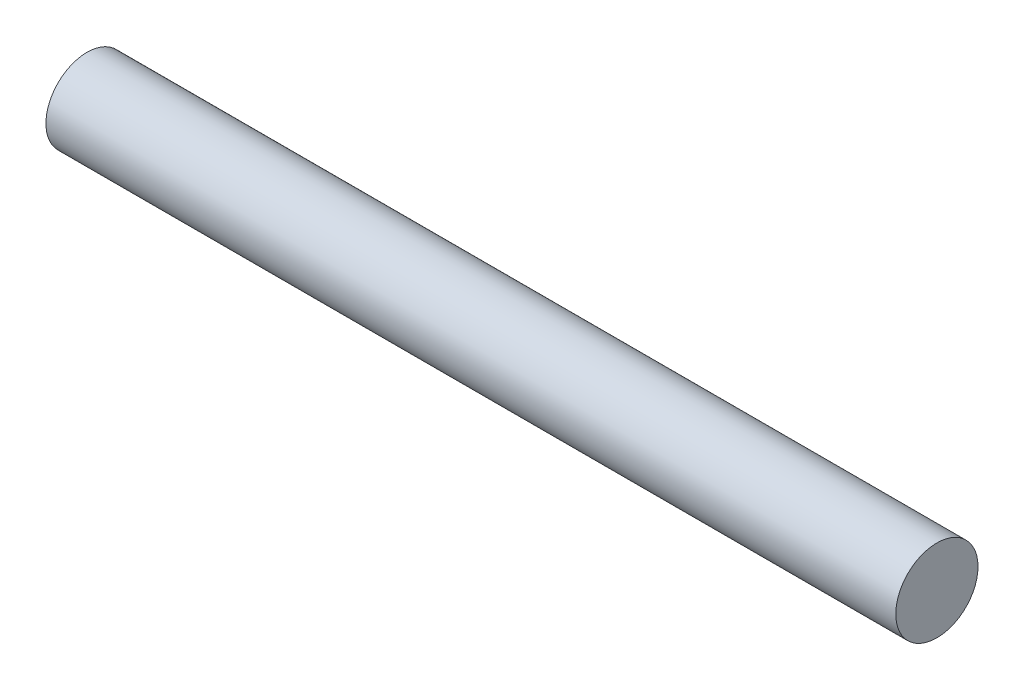
from build123d import *

# Parameters (mm, degrees)
SKETCH1_R           = 4.5
BOSS_EXTRUDE1_DEPTH = 93
CUT_EXTRUDE1_DEPTH  = 1


with BuildPart() as part:
    # Sketch1 → Boss-Extrude1 (new body)
    with BuildSketch(Plane(origin=(0, 0, 0), x_dir=(0, 0, -1), z_dir=(1, 0, 0))):
        with Locations(Location((0, 0, 0), (0, 0, 180))):
            Circle(SKETCH1_R)
    extrude(amount=BOSS_EXTRUDE1_DEPTH)

    # Sketch2 → Cut-Extrude1 (cut)
    # profile 1 of 6: a face of its own
    with BuildSketch(Plane(origin=(0, 0, -4.5), x_dir=(-1, 0, 0), z_dir=(0, 0, -1))):
        with BuildLine():
            Line((-51.504249312, 0.93588405), (-51.658483587, 0.80168433))
            add(Edge.make_bspline(
                [(-51.658483587, 0.80168433), (-51.682680833, 0.822813409), (-51.729786546, 0.863946201), (-51.803544139, 0.918280559), (-51.877714446, 0.964110102), (-51.952317104, 1.000887718), (-52.026092846, 1.030344179), (-52.099377852, 1.050595394), (-52.171589413, 1.063825819), (-52.219608453, 1.065460893), (-52.243301796, 1.066267663)],
                knots=[0, 0, 0, 0, 1.174203348, 2.285866929, 3.345479548, 4.357773815, 5.323690501, 6.245291137, 7.134199255, 8, 8, 8, 8], degree=3))
            add(Edge.make_bspline(
                [(-52.243301796, 1.066267663), (-52.256987604, 1.066053279), (-52.28431643, 1.065625181), (-52.325090263, 1.061223075), (-52.365466545, 1.054656517), (-52.405469856, 1.045258656), (-52.445184825, 1.033671189), (-52.484307451, 1.01889454), (-52.523078464, 1.001609771), (-52.561183632, 0.981718256), (-52.598220313, 0.959652067), (-52.633421041, 0.935367083), (-52.666566358, 0.908902737), (-52.697718378, 0.880333906), (-52.726694149, 0.849616982), (-52.753923076, 0.817193865), (-52.778699937, 0.782304492), (-52.801507037, 0.745700204), (-52.82161973, 0.707640966), (-52.839722592, 0.669042627), (-52.854625437, 0.629577847), (-52.866686237, 0.589378017), (-52.876292343, 0.548495713), (-52.883265639, 0.506975971), (-52.887580874, 0.464687013), (-52.888008118, 0.43630243), (-52.888223671, 0.421981806)],
                knots=[0, 0, 0, 0, 0.9732313, 1.943419598, 2.914105962, 3.881741322, 4.864768402, 5.855028487, 6.854206409, 7.882911434, 8.911035887, 9.919250175, 10.922630637, 11.925982763, 12.923451909, 13.924676513, 14.935397504, 15.964931351, 16.990480746, 17.995899336, 18.995873688, 19.988284801, 20.979664002, 21.981342857, 22.981544644, 24, 24, 24, 24], degree=3))
            add(Edge.make_bspline(
                [(-52.888223671, 0.421981806), (-52.887859105, 0.407345906), (-52.887131227, 0.378124466), (-52.883090163, 0.334626805), (-52.875691921, 0.291928846), (-52.865415293, 0.249982462), (-52.852431695, 0.20873611), (-52.836508135, 0.168083565), (-52.817217505, 0.128432205), (-52.795824555, 0.089417715), (-52.771750803, 0.051973789), (-52.74516781, 0.016679783), (-52.716973044, -0.016920192), (-52.686320176, -0.047890755), (-52.654133154, -0.077268161), (-52.619289832, -0.103760891), (-52.582769256, -0.128671137), (-52.544328165, -0.151237262), (-52.504306788, -0.171138722), (-52.463368575, -0.188698257), (-52.421379783, -0.203378731), (-52.378599726, -0.215479126), (-52.334803993, -0.224680453), (-52.290310373, -0.231283397), (-52.244873975, -0.235679651), (-52.214267359, -0.236089206), (-52.198780562, -0.236296439)],
                knots=[0, 0, 0, 0, 0.993588149, 1.983757546, 2.962012758, 3.932297264, 4.913089422, 5.895147596, 6.892791648, 7.904042674, 8.913936126, 9.911190904, 10.901569418, 11.888649192, 12.866825019, 13.856968273, 14.856789458, 15.866221433, 16.879824684, 17.888846278, 18.887838639, 19.896937192, 20.90452114, 21.923117541, 22.949107649, 24, 24, 24, 24], degree=3))
            add(Edge.make_bspline(
                [(-52.198780562, -0.236296439), (-52.179468786, -0.235861841), (-52.14137558, -0.235004581), (-52.085460528, -0.228440235), (-52.031691729, -0.218304732), (-51.980617041, -0.202551834), (-51.931422057, -0.183815113), (-51.884840657, -0.159946502), (-51.840315084, -0.132271765), (-51.798802114, -0.100162562), (-51.760114408, -0.065578891), (-51.725661578, -0.028347496), (-51.694850486, 0.010323662), (-51.6688733, 0.051363292), (-51.64632454, 0.093621142), (-51.628462927, 0.137988147), (-51.614617423, 0.184087288), (-51.608891411, 0.215843954), (-51.606012133, 0.231812535)],
                knots=[0, 0, 0, 0, 1.125101743, 2.219305524, 3.276925285, 4.308813505, 5.329771737, 6.340890082, 7.353855978, 8.380572537, 9.395307413, 10.374367262, 11.333343716, 12.272376171, 13.200803521, 14.12078735, 15.055053215, 16, 16, 16, 16], degree=3))
            Line((-51.606012133, 0.231812535), (-52.114826235, 0.231812535))
            Line((-52.114826235, 0.231812535), (-52.114826235, 0.414985612))
            Line((-52.114826235, 0.414985612), (-51.402486492, 0.414985612))
            add(Edge.make_bspline(
                [(-51.402486492, 0.414985612), (-51.403207895, 0.38357223), (-51.404616154, 0.32224978), (-51.415921828, 0.232862097), (-51.432591493, 0.148333231), (-51.456945596, 0.069019756), (-51.487803815, -0.005190106), (-51.525492335, -0.074298119), (-51.569937114, -0.138284146), (-51.62083835, -0.196787374), (-51.677428215, -0.249264004), (-51.739106542, -0.295219841), (-51.806149847, -0.333361816), (-51.877701845, -0.365048658), (-51.954158683, -0.389531675), (-52.035323502, -0.406872796), (-52.121323091, -0.417600474), (-52.18030387, -0.418835992), (-52.210546888, -0.419469516)],
                knots=[0, 0, 0, 0, 1.147910205, 2.240849596, 3.288798376, 4.293882934, 5.268269983, 6.221997348, 7.165762291, 8.110600512, 9.051082397, 9.981847279, 10.915696266, 11.864665164, 12.837641225, 13.844673414, 14.894833504, 16, 16, 16, 16], degree=3))
            add(Edge.make_bspline(
                [(-52.210546888, -0.419469516), (-52.228361467, -0.419209153), (-52.263600604, -0.418694129), (-52.315697036, -0.415085424), (-52.366458751, -0.409508893), (-52.415675903, -0.401137536), (-52.463614312, -0.390780586), (-52.509883603, -0.377534932), (-52.555113373, -0.362857613), (-52.598503372, -0.344713556), (-52.640977835, -0.325243881), (-52.681832376, -0.302836888), (-52.721104478, -0.277879088), (-52.759625405, -0.251358211), (-52.795914737, -0.22159859), (-52.831189622, -0.190022306), (-52.864906546, -0.155988876), (-52.886120596, -0.131783688), (-52.896809909, -0.119587204)],
                knots=[0, 0, 0, 0, 1.103516608, 2.18287355, 3.233646581, 4.265703846, 5.274262808, 6.270085734, 7.246073526, 8.217965859, 9.181570311, 10.139587173, 11.101556858, 12.063436887, 13.034641265, 14.006444858, 14.995489556, 16, 16, 16, 16], degree=3))
            add(Edge.make_bspline(
                [(-52.896809909, -0.119587204), (-52.912475792, -0.100269496), (-52.943471021, -0.062049065), (-52.982526601, -0.000139219), (-53.01681448, 0.063231725), (-53.044072786, 0.129394956), (-53.06548806, 0.197705049), (-53.080846776, 0.268349573), (-53.089781658, 0.341295266), (-53.091089211, 0.390686906), (-53.091749312, 0.41562163)],
                knots=[0, 0, 0, 0, 1.024988564, 2.027958144, 3.013741914, 3.99376912, 4.974186348, 5.962951834, 6.97162285, 8, 8, 8, 8], degree=3))
            add(Edge.make_bspline(
                [(-53.091749312, 0.41562163), (-53.091511529, 0.434293671), (-53.091040329, 0.471294906), (-53.085195567, 0.526277218), (-53.076814343, 0.580376261), (-53.064705023, 0.633506586), (-53.049061924, 0.685559865), (-53.029832663, 0.736610847), (-53.007385123, 0.786837829), (-52.981155873, 0.835628328), (-52.952609137, 0.882971758), (-52.920526794, 0.927397348), (-52.886553213, 0.969741382), (-52.849499027, 1.008987315), (-52.810427457, 1.046227142), (-52.768205934, 1.080151372), (-52.723709537, 1.111767898), (-52.676556013, 1.140318097), (-52.627514665, 1.165974242), (-52.57668949, 1.188475709), (-52.524179761, 1.206992931), (-52.470351279, 1.222887591), (-52.414786795, 1.234447332), (-52.357776274, 1.242983233), (-52.299176232, 1.248723479), (-52.259533906, 1.249199834), (-52.23948569, 1.24944074)],
                knots=[0, 0, 0, 0, 1.010042427, 2.001538926, 2.988977894, 3.97147212, 4.947868168, 5.928132478, 6.921817128, 7.922678872, 8.924230854, 9.911186466, 10.885946514, 11.860014231, 12.829900618, 13.804660667, 14.788293046, 15.781961137, 16.785220236, 17.781814947, 18.787040195, 19.796447094, 20.816926666, 21.855387176, 22.915410262, 24, 24, 24, 24], degree=3))
            add(Edge.make_bspline(
                [(-52.23948569, 1.24944074), (-52.222627234, 1.249141651), (-52.189093921, 1.248546731), (-52.139196887, 1.245450756), (-52.090037736, 1.239752917), (-52.04172484, 1.231257321), (-51.993969606, 1.22134907), (-51.947212574, 1.208487626), (-51.901271753, 1.193497944), (-51.855921529, 1.176279059), (-51.810974463, 1.156535333), (-51.766304452, 1.133955092), (-51.722102222, 1.107975416), (-51.677901639, 1.079414314), (-51.633979481, 1.047873014), (-51.590405658, 1.013332353), (-51.54665192, 0.97627151), (-51.518534933, 0.949490758), (-51.504249312, 0.93588405)],
                knots=[0, 0, 0, 0, 0.985310127, 1.959889608, 2.920407961, 3.875718043, 4.825872088, 5.769643135, 6.708031182, 7.649175746, 8.603380435, 9.575831151, 10.572468945, 11.59831001, 12.650450436, 13.731164539, 14.847254788, 16, 16, 16, 16], degree=3))
        make_face()
    # profile 2 of 6: a face of its own
    with BuildSketch(Plane(origin=(0, 0, -4.5), x_dir=(-1, 0, 0), z_dir=(0, 0, -1))):
        with BuildLine():
            Line((-51.178608286, 0.80168433), (-50.975082645, 0.80168433))
            Line((-50.975082645, 0.80168433), (-50.975082645, 0.634093685))
            add(Edge.make_bspline(
                [(-50.975082645, 0.634093685), (-50.97385457, 0.641755912), (-50.97145754, 0.656711493), (-50.965411162, 0.678203369), (-50.957048242, 0.698156891), (-50.946536587, 0.716594762), (-50.93407046, 0.733587014), (-50.919523352, 0.749027495), (-50.902962931, 0.76313248), (-50.877908425, 0.779254276), (-50.845013498, 0.796306052), (-50.803739184, 0.811104415), (-50.76148525, 0.820479223), (-50.7328076, 0.821517206), (-50.718449532, 0.822036894)],
                knots=[0, 0, 0, 0, 0.801625561, 1.56465941, 2.301277113, 3.032414989, 3.753384473, 4.4742707, 5.220602463, 5.995500889, 7.548895402, 9.039144265, 10.517585467, 12, 12, 12, 12], degree=3))
            add(Edge.make_bspline(
                [(-50.718449532, 0.822036894), (-50.705463332, 0.821265727), (-50.678180926, 0.819645599), (-50.636273904, 0.808843641), (-50.592146038, 0.791015623), (-50.562998864, 0.775079537), (-50.547678799, 0.766703361)],
                knots=[0, 0, 0, 0, 0.858860638, 1.804360244, 2.845948385, 4, 4, 4, 4], degree=3))
            Line((-50.547678799, 0.766703361), (-50.64403547, 0.618829262))
            add(Edge.make_bspline(
                [(-50.64403547, 0.618829262), (-50.65502657, 0.621938431), (-50.67510526, 0.627618302), (-50.702781865, 0.633404642), (-50.72467965, 0.637790047), (-50.737517298, 0.638545101), (-50.742936211, 0.638863817)],
                knots=[0, 0, 0, 0, 1.354987806, 2.475310119, 3.356411532, 4, 4, 4, 4], degree=3))
            add(Edge.make_bspline(
                [(-50.742936211, 0.638863817), (-50.75181551, 0.638212682), (-50.770504281, 0.636842199), (-50.79838268, 0.626070646), (-50.827006124, 0.609451834), (-50.850588143, 0.59084355), (-50.869506631, 0.572655001), (-50.883041807, 0.555970874), (-50.896178231, 0.537088632), (-50.908510353, 0.515817063), (-50.919891282, 0.492138282), (-50.930654518, 0.466325397), (-50.940993541, 0.438280886), (-50.94669401, 0.418524309), (-50.94964194, 0.408307427)],
                knots=[0, 0, 0, 0, 0.965356871, 2.031842204, 3.216327082, 4.56533618, 5.292082419, 6.07124699, 6.900886396, 7.796081313, 8.746333432, 9.760722644, 10.841983902, 12, 12, 12, 12], degree=3))
            add(Edge.make_bspline(
                [(-50.94964194, 0.408307427), (-50.951794448, 0.399855436), (-50.956623922, 0.380892127), (-50.961170676, 0.348700025), (-50.965748495, 0.310232936), (-50.968968751, 0.265336992), (-50.971936745, 0.214140387), (-50.973624967, 0.156452595), (-50.975024917, 0.09231961), (-50.975062808, 0.04736844), (-50.975082645, 0.023834771)],
                knots=[0, 0, 0, 0, 0.541796663, 1.215601946, 2.018210726, 2.950106988, 4.012619945, 5.205915212, 6.537188929, 8, 8, 8, 8], degree=3))
            Line((-50.975082645, 0.023834771), (-50.975082645, -0.378764388))
            Line((-50.975082645, -0.378764388), (-51.178608286, -0.378764388))
            Line((-51.178608286, -0.378764388), (-51.178608286, 0.80168433))
        make_face()
    # profile 3 of 6: a face of its own
    with BuildSketch(Plane(origin=(0, 0, -4.5), x_dir=(-1, 0, 0), z_dir=(0, 0, -1))):
        with BuildLine():
            add(Edge.make_bspline(
                [(-49.885584448, 0.822036894), (-49.862025974, 0.821391748), (-49.815902928, 0.820128675), (-49.748412752, 0.811242353), (-49.684323974, 0.795802668), (-49.623452913, 0.774670643), (-49.566050083, 0.746984743), (-49.511972111, 0.713489585), (-49.461412341, 0.67353387), (-49.430957026, 0.642896899), (-49.415567421, 0.6274155)],
                knots=[0, 0, 0, 0, 1.078775739, 2.112039281, 3.110494877, 4.093081892, 5.057110616, 6.022958758, 7.000966324, 8, 8, 8, 8], degree=3))
            add(Edge.make_bspline(
                [(-49.415567421, 0.6274155), (-49.401919973, 0.612070692), (-49.375088026, 0.581901602), (-49.340418245, 0.533237429), (-49.310892673, 0.483177101), (-49.287005693, 0.431343212), (-49.267966044, 0.37797279), (-49.25476191, 0.322854949), (-49.246446944, 0.266093962), (-49.245562378, 0.227707433), (-49.245114697, 0.208279883)],
                knots=[0, 0, 0, 0, 1.062178036, 2.088324843, 3.086640365, 4.066023852, 5.037709567, 6.014384934, 6.995073642, 8, 8, 8, 8], degree=3))
            add(Edge.make_bspline(
                [(-49.245114697, 0.208279883), (-49.245674234, 0.188745134), (-49.246783158, 0.150029977), (-49.255366869, 0.092839436), (-49.268942164, 0.037172226), (-49.288470598, -0.016717516), (-49.313603236, -0.068888261), (-49.343754742, -0.119657361), (-49.38010778, -0.168349091), (-49.420981324, -0.21510463), (-49.466403406, -0.258238619), (-49.515973957, -0.296002015), (-49.56908528, -0.327959899), (-49.625641475, -0.354265647), (-49.685912266, -0.374143158), (-49.749313796, -0.388863696), (-49.816335206, -0.397557125), (-49.862132154, -0.398588693), (-49.885584448, -0.399116952)],
                knots=[0, 0, 0, 0, 0.952871876, 1.888459614, 2.815544184, 3.744891397, 4.679563604, 5.637601804, 6.621431805, 7.640342292, 8.664856555, 9.672479278, 10.67487095, 11.683873433, 12.709444777, 13.765907845, 14.855937143, 16, 16, 16, 16], degree=3))
            add(Edge.make_bspline(
                [(-49.885584448, -0.399116952), (-49.907982431, -0.398602515), (-49.951888963, -0.397594069), (-50.016049835, -0.388641274), (-50.07723195, -0.374978299), (-50.134989126, -0.35465179), (-50.189797162, -0.329233091), (-50.24128942, -0.297706249), (-50.289862512, -0.260821313), (-50.334249361, -0.218145257), (-50.374706687, -0.172266967), (-50.409822999, -0.123561074), (-50.440026336, -0.073159944), (-50.464581214, -0.020637257), (-50.48339797, 0.033988102), (-50.49717546, 0.090265343), (-50.505220947, 0.148686713), (-50.506383708, 0.188220956), (-50.506973671, 0.208279883)],
                knots=[0, 0, 0, 0, 1.108842573, 2.173652473, 3.202745058, 4.208988794, 5.200203338, 6.189803525, 7.193715926, 8.215010613, 9.234454675, 10.219573757, 11.184848795, 12.140854958, 13.08565054, 14.042002664, 15.006549187, 16, 16, 16, 16], degree=3))
            add(Edge.make_bspline(
                [(-50.506973671, 0.208279883), (-50.506493174, 0.228125711), (-50.505546501, 0.26722592), (-50.497786301, 0.324878188), (-50.484619646, 0.380273575), (-50.466870059, 0.433860389), (-50.443431834, 0.485230613), (-50.414936987, 0.534674112), (-50.381643201, 0.582373443), (-50.355690218, 0.611652188), (-50.342563114, 0.626461474)],
                knots=[0, 0, 0, 0, 1.034079547, 2.037341334, 3.024980457, 3.998111168, 4.974764182, 5.962233312, 6.969290918, 8, 8, 8, 8], degree=3))
            add(Edge.make_bspline(
                [(-50.342563114, 0.626461474), (-50.327291805, 0.642061484), (-50.297185298, 0.672816006), (-50.24707338, 0.712689194), (-50.194202704, 0.746686411), (-50.138041358, 0.774023823), (-50.079244779, 0.795988702), (-50.01723527, 0.811126804), (-49.952313312, 0.820126103), (-49.908085874, 0.821392562), (-49.885584448, 0.822036894)],
                knots=[0, 0, 0, 0, 1.021997278, 2.014808882, 2.992991082, 3.961403697, 4.935644248, 5.92819495, 6.945935601, 8, 8, 8, 8], degree=3))
        make_face()
        with BuildLine():
            add(Edge.make_bspline(
                [(-49.886220466, 0.638863817), (-49.899809166, 0.638501719), (-49.926790254, 0.637782755), (-49.966531188, 0.631899521), (-50.005157615, 0.622385792), (-50.042245673, 0.608573473), (-50.078355173, 0.591312243), (-50.112879255, 0.569812672), (-50.146595995, 0.544947303), (-50.178277944, 0.516153874), (-50.207754836, 0.484808021), (-50.233294179, 0.450814486), (-50.255142373, 0.415126375), (-50.272639581, 0.377293213), (-50.286464424, 0.337571826), (-50.296137873, 0.295885894), (-50.302513691, 0.252255033), (-50.303132315, 0.222507499), (-50.30344803, 0.207325857)],
                knots=[0, 0, 0, 0, 0.976916649, 1.939720157, 2.882730922, 3.833047911, 4.780976627, 5.756404754, 6.753607, 7.790049989, 8.831165002, 9.84360893, 10.842529111, 11.835057585, 12.835634664, 13.861933882, 14.908838789, 16, 16, 16, 16], degree=3))
            add(Edge.make_bspline(
                [(-50.30344803, 0.207325857), (-50.302725162, 0.187553253), (-50.301302539, 0.148640245), (-50.289677649, 0.091642573), (-50.271228327, 0.037169865), (-50.24546925, -0.014067096), (-50.213979574, -0.060942949), (-50.177273439, -0.101980198), (-50.136754333, -0.137505505), (-50.091639983, -0.166033675), (-50.043477183, -0.188362391), (-49.992917784, -0.204258367), (-49.940246882, -0.214193047), (-49.904390894, -0.215355028), (-49.886220466, -0.215943875)],
                knots=[0, 0, 0, 0, 1.073737222, 2.11314337, 3.147909503, 4.191315005, 5.220292011, 6.207728104, 7.175628903, 8.139268678, 9.098074859, 10.052770626, 11.013219503, 12, 12, 12, 12], degree=3))
            add(Edge.make_bspline(
                [(-49.886220466, -0.215943875), (-49.866564356, -0.215272274), (-49.827830952, -0.213948848), (-49.771100561, -0.203430425), (-49.716923162, -0.186541887), (-49.665678383, -0.163004195), (-49.618120547, -0.133185157), (-49.575593857, -0.096995125), (-49.538322873, -0.055034068), (-49.506409513, -0.00826198), (-49.480638107, 0.042485976), (-49.46213563, 0.09574582), (-49.450912879, 0.150995688), (-49.449403637, 0.188405727), (-49.448640338, 0.207325857)],
                knots=[0, 0, 0, 0, 1.042880454, 2.055051067, 3.051726387, 4.048830532, 5.040201766, 6.022282375, 7.002717173, 8.011000956, 9.020163719, 10.014978664, 10.996075346, 12, 12, 12, 12], degree=3))
            add(Edge.make_bspline(
                [(-49.448640338, 0.207325857), (-49.448972, 0.221975843), (-49.449626248, 0.250874904), (-49.455870711, 0.293393412), (-49.466005355, 0.334335222), (-49.480406884, 0.373517477), (-49.498644228, 0.41107648), (-49.521083032, 0.446852114), (-49.547643799, 0.48101491), (-49.577922496, 0.513011951), (-49.610744846, 0.542431803), (-49.645425923, 0.568412946), (-49.681894554, 0.589991203), (-49.719645279, 0.608175409), (-49.759210607, 0.621687883), (-49.800183926, 0.631587314), (-49.842669884, 0.637890878), (-49.871569963, 0.638536518), (-49.886220466, 0.638863817)],
                knots=[0, 0, 0, 0, 1.02928639, 2.030405262, 3.013559112, 3.98951401, 4.959304921, 5.943474834, 6.952548865, 7.996299005, 9.035918103, 10.047849461, 11.03697177, 12.01024899, 12.98822153, 13.969594738, 14.97071361, 16, 16, 16, 16], degree=3))
        make_face(mode=Mode.SUBTRACT)
    # profile 4 of 6: a face of its own
    with BuildSketch(Plane(origin=(0, 0, -4.5), x_dir=(-1, 0, 0), z_dir=(0, 0, -1))):
        with BuildLine():
            Line((-49.000883927, 0.80168433), (-48.797358286, 0.80168433))
            Line((-48.797358286, 0.80168433), (-48.797358286, 0.253755143))
            add(Edge.make_bspline(
                [(-48.797358286, 0.253755143), (-48.797298552, 0.238278457), (-48.79718398, 0.208593914), (-48.796286169, 0.165970328), (-48.794572805, 0.12739328), (-48.792980555, 0.092789205), (-48.789876366, 0.062287557), (-48.787043475, 0.03559045), (-48.782921405, 0.01299377), (-48.779505559, -0.000560303), (-48.777959749, -0.006694075)],
                knots=[0, 0, 0, 0, 1.418944939, 2.721560048, 3.90822129, 4.959445687, 5.896519748, 6.718644391, 7.420134194, 8, 8, 8, 8], degree=3))
            add(Edge.make_bspline(
                [(-48.777959749, -0.006694075), (-48.772148364, -0.023157306), (-48.760915308, -0.054979739), (-48.735339577, -0.097760207), (-48.704469262, -0.134578477), (-48.667247298, -0.164260905), (-48.625728194, -0.187777399), (-48.57996667, -0.203607439), (-48.531057574, -0.214490667), (-48.497115118, -0.215450491), (-48.479667481, -0.215943875)],
                knots=[0, 0, 0, 0, 1.064698082, 2.057997224, 3.027713519, 3.985869738, 4.951769774, 5.929245647, 6.93555818, 8, 8, 8, 8], degree=3))
            add(Edge.make_bspline(
                [(-48.479667481, -0.215943875), (-48.460642995, -0.21530034), (-48.423892984, -0.21405721), (-48.371047635, -0.203701094), (-48.322689505, -0.186668446), (-48.279696302, -0.162075898), (-48.241598872, -0.132825161), (-48.210318966, -0.098164575), (-48.184153409, -0.060066928), (-48.173002208, -0.031555847), (-48.167382826, -0.017188366)],
                knots=[0, 0, 0, 0, 1.152522955, 2.226353534, 3.250900004, 4.246517978, 5.217118907, 6.149589309, 7.067529598, 8, 8, 8, 8], degree=3))
            add(Edge.make_bspline(
                [(-48.167382826, -0.017188366), (-48.165560854, -0.011175892), (-48.161517534, 0.00216699), (-48.157908483, 0.024953143), (-48.153827391, 0.051931403), (-48.15135309, 0.083605758), (-48.148577357, 0.119728415), (-48.147230055, 0.160464936), (-48.14622322, 0.205624276), (-48.146126738, 0.237217832), (-48.146076235, 0.253755143)],
                knots=[0, 0, 0, 0, 0.552623276, 1.226381414, 2.027670893, 2.955584593, 4.022320098, 5.218031084, 6.543807858, 8, 8, 8, 8], degree=3))
            Line((-48.146076235, 0.253755143), (-48.146076235, 0.80168433))
            Line((-48.146076235, 0.80168433), (-47.942550594, 0.80168433))
            Line((-47.942550594, 0.80168433), (-47.942550594, 0.226088377))
            add(Edge.make_bspline(
                [(-47.942550594, 0.226088377), (-47.942759255, 0.207218035), (-47.943165049, 0.170519833), (-47.945556394, 0.117249444), (-47.950171622, 0.06741964), (-47.955771482, 0.021045064), (-47.964420653, -0.021711426), (-47.973545643, -0.061152325), (-47.985089024, -0.097077598), (-47.99851314, -0.12981998), (-48.013912587, -0.159982532), (-48.031292358, -0.188156979), (-48.050409391, -0.215021594), (-48.071591707, -0.240412947), (-48.095099621, -0.263992798), (-48.120190734, -0.286434723), (-48.147633334, -0.307004545), (-48.176884412, -0.326135191), (-48.208147346, -0.343464719), (-48.241530434, -0.358213598), (-48.276618339, -0.371150713), (-48.313830574, -0.381120666), (-48.352844702, -0.389532546), (-48.393877735, -0.395157029), (-48.436793761, -0.398263885), (-48.465988102, -0.398828033), (-48.480939516, -0.399116952)],
                knots=[0, 0, 0, 0, 1.433126784, 2.78708125, 4.047948649, 5.23317835, 6.332013834, 7.359028814, 8.306074614, 9.194073739, 10.043734443, 10.874888521, 11.705886645, 12.545920784, 13.382708552, 14.23240739, 15.100217466, 15.98441358, 16.885165303, 17.811245298, 18.753488952, 19.72218431, 20.734230158, 21.782757764, 22.864474903, 24, 24, 24, 24], degree=3))
            add(Edge.make_bspline(
                [(-48.480939516, -0.399116952), (-48.495047124, -0.39900273), (-48.522672904, -0.398779058), (-48.563100417, -0.395006563), (-48.601880942, -0.389725746), (-48.638976834, -0.382149724), (-48.674384378, -0.372322246), (-48.707965632, -0.360170948), (-48.739870922, -0.345844367), (-48.770053408, -0.329333713), (-48.798348721, -0.310819722), (-48.824941118, -0.290780447), (-48.849427203, -0.268777129), (-48.872029772, -0.24506486), (-48.893255934, -0.220066412), (-48.911865172, -0.192755778), (-48.929133546, -0.164176096), (-48.944665583, -0.133553026), (-48.958164888, -0.100075192), (-48.969416782, -0.062985486), (-48.979288125, -0.022337159), (-48.987097581, 0.022189936), (-48.993443451, 0.070351636), (-48.997832033, 0.122454329), (-49.000285445, 0.17825703), (-49.000680502, 0.216757684), (-49.000883927, 0.236582667)],
                knots=[0, 0, 0, 0, 1.07579807, 2.106647768, 3.094742466, 4.060581056, 4.992547774, 5.895540969, 6.78231141, 7.658099749, 8.517151737, 9.359794672, 10.195893314, 11.025198922, 11.857652707, 12.69437682, 13.543128465, 14.403853537, 15.310857085, 16.293043939, 17.358059167, 18.500139289, 19.739904812, 21.062881797, 22.487601799, 24, 24, 24, 24], degree=3))
            Line((-49.000883927, 0.236582667), (-49.000883927, 0.80168433))
        make_face()
    # profile 5 of 6: a face of its own
    with BuildSketch(Plane(origin=(0, 0, -4.5), x_dir=(-1, 0, 0), z_dir=(0, 0, -1))):
        with BuildLine():
            Line((-47.616909569, 0.80168433), (-47.413383927, 0.80168433))
            Line((-47.413383927, 0.80168433), (-47.413383927, 0.591162495))
            add(Edge.make_bspline(
                [(-47.413383927, 0.591162495), (-47.410331047, 0.600583084), (-47.404292844, 0.619215796), (-47.391202988, 0.645393759), (-47.3760232, 0.670004288), (-47.358056724, 0.692686121), (-47.337579025, 0.713603616), (-47.314101694, 0.73226287), (-47.288286923, 0.74966144), (-47.249852578, 0.76967385), (-47.198572111, 0.791024742), (-47.13330289, 0.809031261), (-47.06480739, 0.820194577), (-47.018036208, 0.821415786), (-46.99424831, 0.822036894)],
                knots=[0, 0, 0, 0, 0.694622356, 1.37387354, 2.049401652, 2.722628407, 3.401757179, 4.100556256, 4.825325589, 5.584715007, 7.140148756, 8.717099778, 10.330311678, 12, 12, 12, 12], degree=3))
            add(Edge.make_bspline(
                [(-46.99424831, 0.822036894), (-46.972275747, 0.821507539), (-46.928901292, 0.820462576), (-46.86536176, 0.811587539), (-46.804241099, 0.797740261), (-46.746023971, 0.777561676), (-46.690215172, 0.751903114), (-46.63697702, 0.720830658), (-46.586765642, 0.68337591), (-46.539538954, 0.641298406), (-46.49671824, 0.595075195), (-46.458531144, 0.546836246), (-46.426622329, 0.496237313), (-46.400135553, 0.443860623), (-46.380322492, 0.389190919), (-46.365367309, 0.332855771), (-46.356683752, 0.274378748), (-46.35559907, 0.234702568), (-46.355050594, 0.214640059)],
                knots=[0, 0, 0, 0, 1.076228782, 2.124505721, 3.137534021, 4.142835799, 5.137588531, 6.143359867, 7.157306602, 8.202064418, 9.238473371, 10.241181928, 11.212440163, 12.164848115, 13.111430887, 14.056330489, 15.017171362, 16, 16, 16, 16], degree=3))
            add(Edge.make_bspline(
                [(-46.355050594, 0.214640059), (-46.355587514, 0.194150863), (-46.356649485, 0.15362535), (-46.365499054, 0.093958019), (-46.379755226, 0.036395122), (-46.399994239, -0.018994468), (-46.425829241, -0.0723012), (-46.457533568, -0.123407478), (-46.49497496, -0.172242353), (-46.537654125, -0.218229333), (-46.584211349, -0.26057263), (-46.634078802, -0.297784163), (-46.686758202, -0.329076185), (-46.742212901, -0.354619072), (-46.800192587, -0.374879441), (-46.861129848, -0.388623338), (-46.924551074, -0.397565919), (-46.967822551, -0.398594586), (-46.989796187, -0.399116952)],
                knots=[0, 0, 0, 0, 1.000690261, 1.979261891, 2.940227073, 3.893808351, 4.855122405, 5.829614775, 6.827190625, 7.857089307, 8.891134036, 9.89799758, 10.891950105, 11.879132496, 12.876641118, 13.886749785, 14.926872999, 16, 16, 16, 16], degree=3))
            add(Edge.make_bspline(
                [(-46.989796187, -0.399116952), (-47.013260904, -0.398346104), (-47.059488869, -0.396827453), (-47.127442028, -0.385912055), (-47.192189964, -0.367213969), (-47.243694334, -0.346380169), (-47.2817906, -0.325599148), (-47.308218661, -0.308711852), (-47.332070756, -0.289960908), (-47.353401585, -0.269554098), (-47.372376636, -0.247822814), (-47.388772343, -0.224418635), (-47.402417653, -0.19924671), (-47.409721397, -0.181562559), (-47.413383927, -0.172694676)],
                knots=[0, 0, 0, 0, 1.656042569, 3.26257835, 4.842282913, 6.405528061, 7.172280682, 7.902838742, 8.616847869, 9.310130132, 9.983752423, 10.650062733, 11.323061395, 12, 12, 12, 12], degree=3))
            Line((-47.413383927, -0.172694676), (-47.413383927, -0.806168234))
            Line((-47.413383927, -0.806168234), (-47.616909569, -0.806168234))
            Line((-47.616909569, -0.806168234), (-47.616909569, 0.80168433))
        make_face()
        with BuildLine():
            add(Edge.make_bspline(
                [(-46.996792381, 0.638863817), (-47.010807254, 0.638519882), (-47.038426847, 0.637842077), (-47.079060857, 0.631780653), (-47.11823126, 0.62280398), (-47.15595724, 0.609523235), (-47.192051394, 0.59240532), (-47.226626533, 0.571428183), (-47.259971415, 0.547253036), (-47.291106076, 0.519133436), (-47.319528097, 0.48807249), (-47.345084907, 0.454976892), (-47.365967037, 0.419130599), (-47.383230048, 0.381284945), (-47.397105175, 0.341425727), (-47.406456446, 0.299157763), (-47.412356432, 0.254770731), (-47.413036706, 0.224411614), (-47.413383927, 0.208915901)],
                knots=[0, 0, 0, 0, 1.005723403, 1.982013728, 2.943867151, 3.887478966, 4.847584166, 5.806995223, 6.787400874, 7.800641986, 8.813368399, 9.807417327, 10.796880851, 11.78458637, 12.790712903, 13.821019732, 14.887818371, 16, 16, 16, 16], degree=3))
            add(Edge.make_bspline(
                [(-47.413383927, 0.208915901), (-47.412743689, 0.188517651), (-47.411494223, 0.14870915), (-47.400794614, 0.090786465), (-47.382880724, 0.036710747), (-47.358333155, -0.013512087), (-47.327455695, -0.059100768), (-47.290759244, -0.099430847), (-47.249170591, -0.135010571), (-47.20209569, -0.163750552), (-47.152235829, -0.186932453), (-47.100621228, -0.203437738), (-47.048023718, -0.214315138), (-47.012428067, -0.215399664), (-46.994566319, -0.215943875)],
                knots=[0, 0, 0, 0, 1.102029977, 2.150682694, 3.17089293, 4.172933106, 5.163105818, 6.136792055, 7.112634256, 8.111227658, 9.108587182, 10.078099529, 11.035598473, 12, 12, 12, 12], degree=3))
            add(Edge.make_bspline(
                [(-46.994566319, -0.215943875), (-46.975651466, -0.215277437), (-46.938161417, -0.213956529), (-46.882907067, -0.203174773), (-46.829756396, -0.18499565), (-46.778583577, -0.160751483), (-46.730953747, -0.129642601), (-46.687968004, -0.09231666), (-46.64977147, -0.049504338), (-46.617773911, -0.001199981), (-46.591320776, 0.050097689), (-46.572523708, 0.103490489), (-46.560819475, 0.157951268), (-46.559325176, 0.194654436), (-46.558576235, 0.213050015)],
                knots=[0, 0, 0, 0, 1.003862332, 1.989698134, 2.97583922, 3.980411469, 4.988981437, 5.986622354, 6.995396503, 8.025784312, 9.055403073, 10.052376809, 11.023853872, 12, 12, 12, 12], degree=3))
            add(Edge.make_bspline(
                [(-46.558576235, 0.213050015), (-46.559317175, 0.231552682), (-46.560791292, 0.268364188), (-46.572493642, 0.322691043), (-46.590996037, 0.375677199), (-46.617105762, 0.426381642), (-46.648965521, 0.473903289), (-46.686264297, 0.516738913), (-46.729518874, 0.553167834), (-46.777136504, 0.584027748), (-46.828510545, 0.60839136), (-46.882544828, 0.626088294), (-46.938906383, 0.636910598), (-46.977346311, 0.638207658), (-46.996792381, 0.638863817)],
                knots=[0, 0, 0, 0, 0.980928904, 1.951581945, 2.935231878, 3.951401631, 4.96844259, 5.964697687, 6.954166899, 7.958816287, 8.967613111, 9.961818216, 10.968920427, 12, 12, 12, 12], degree=3))
        make_face(mode=Mode.SUBTRACT)
    # profile 6 of 6: a face of its own
    with BuildSketch(Plane(origin=(0, 0, -4.5), x_dir=(-1, 0, 0), z_dir=(0, 0, -1))):
        Polygon((-44.705538875, 1.24944074), (-44.625082645, 1.24944074), (-44.625082645, 0.170754843), (-44.441909569, 0.170754843), (-44.441909569, -0.012418234), (-44.625082645, -0.012418234), (-44.625082645, -0.378764388), (-44.828608286, -0.378764388), (-44.828608286, -0.012418234), (-45.561300594, -0.012418234), align=None)
        Polygon((-44.828608286, 0.170754843), (-44.828608286, 0.802002339), (-45.232797489, 0.170754843), align=None, mode=Mode.SUBTRACT)
    extrude(amount=-CUT_EXTRUDE1_DEPTH, mode=Mode.SUBTRACT)


solid = part.part
